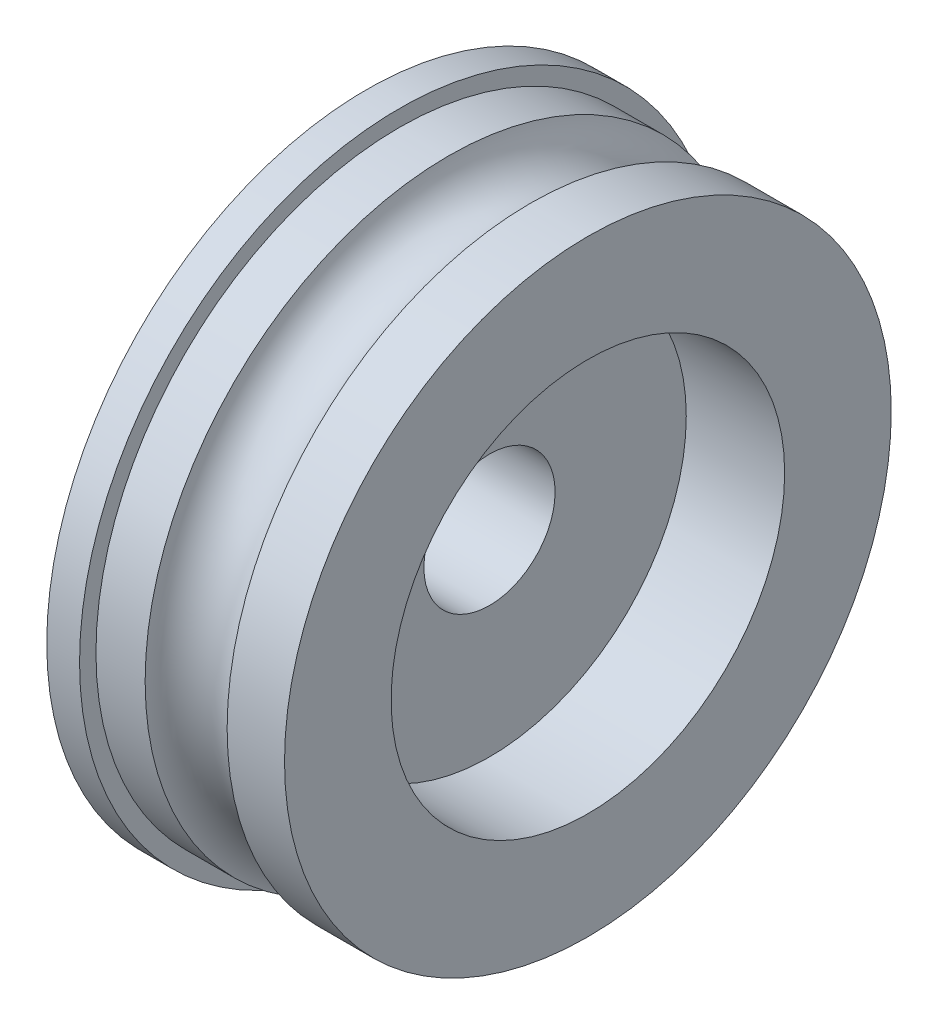
from build123d import *

# Parameters (mm, degrees)
SKETCH2_R          = 6
CUT_EXTRUDE1_DEPTH = 3


with BuildPart() as part:
    # Sketch1 → Revolve1 (revolve)
    with BuildSketch(Plane(origin=(0, 0, 0), x_dir=(1, 0, 0), z_dir=(0, 1, 0)), mode=Mode.PRIVATE) as revolve1_sk:
        with BuildLine():
            Line((-3.490371622, 9.75), (-2.490371622, 9.75))
            Line((-2.490371622, 9.75), (-2.490371622, 9.25))
            Line((-2.490371622, 9.25), (-0.990371622, 9.25))
            ThreePointArc((-0.990371622, 9.25), (0.259628378, 8.225245122), (1.509628378, 9.25))
            Line((1.509628378, 9.25), (3.259628378, 9.25))
            Line((3.259628378, 9.25), (3.259628378, 2))
            Line((3.259628378, 2), (-3.490371622, 2))
            Line((-3.490371622, 2), (-3.490371622, 9.75))
        make_face()
    revolve(revolve1_sk.sketch.rotate(Axis((-2.728053472, 0, 0), (1, 0, 0)), 180), axis=Axis((-2.728053472, 0, 0), (1, 0, 0)))

    # Sketch2 → Cut-Extrude1 (cut)
    with BuildSketch(Plane(origin=(3.259628378, 0, 0), x_dir=(0, 0, -1), z_dir=(1, 0, 0))):
        Circle(SKETCH2_R)
    extrude(amount=-CUT_EXTRUDE1_DEPTH, mode=Mode.SUBTRACT)


solid = part.part
